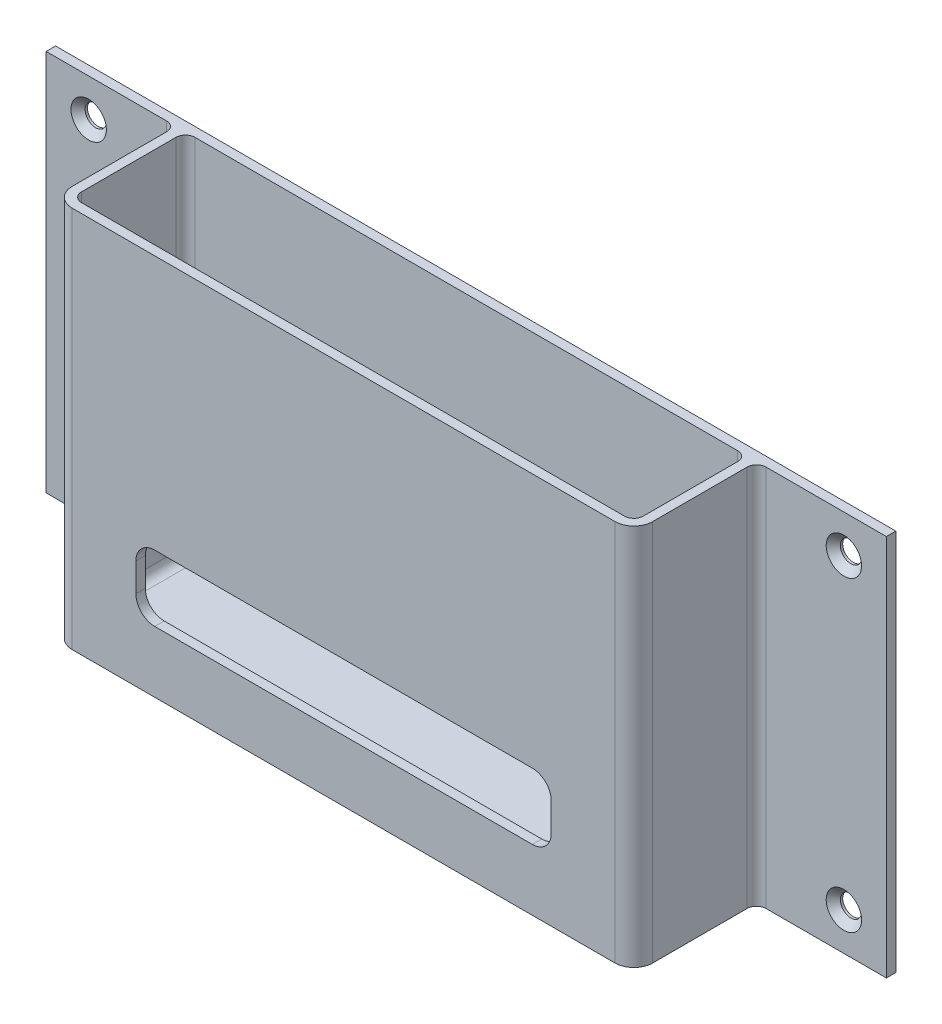
from build123d import *

# Parameters (mm, degrees)
BOSS_EXTRUDE1_DEPTH = 78
BOSS_EXTRUDE2_START = 3
BOSS_EXTRUDE2_DEPTH = 3
CUT_EXTRUDE1_DEPTH  = 2
FILLET1_R           = 2
SKETCH5_R           = 2.25
CUT_EXTRUDE2_DEPTH  = 122.165176515
CHAMFER1_SIZE       = 1.5


with BuildPart() as part:
    # Sketch2 → Boss-Extrude1 (new body)
    with BuildSketch(Plane(origin=(0, 0, 0), x_dir=(1, 0, 0), z_dir=(0, 1, 0))):
        with BuildLine():
            Line((89, 0), (-89, 0))
            Line((-89, 0), (-89, -2))
            Line((-89, -2), (-63.5, -2))
            ThreePointArc((-63.5, -2), (-62.085786438, -2.585786438), (-61.5, -4))
            Line((-61.5, -4), (-61.5, -24))
            ThreePointArc((-61.5, -24), (-60.328427125, -26.828427125), (-57.5, -28))
            Line((-57.5, -28), (57.5, -28))
            ThreePointArc((57.5, -28), (60.328427125, -26.828427125), (61.5, -24))
            Line((61.5, -24), (61.5, -4))
            ThreePointArc((61.5, -4), (62.085786438, -2.585786438), (63.5, -2))
            Line((63.5, -2), (89, -2))
            Line((89, -2), (89, 0))
        make_face()
        with BuildLine():
            Line((57.5, -2), (-57.5, -2))
            ThreePointArc((-57.5, -2), (-58.914213562, -2.585786438), (-59.5, -4))
            Line((-59.5, -4), (-59.5, -24))
            ThreePointArc((-59.5, -24), (-58.914213562, -25.414213562), (-57.5, -26))
            Line((-57.5, -26), (57.5, -26))
            ThreePointArc((57.5, -26), (58.914213562, -25.414213562), (59.5, -24))
            Line((59.5, -24), (59.5, -4))
            ThreePointArc((59.5, -4), (58.914213562, -2.585786438), (57.5, -2))
        make_face(mode=Mode.SUBTRACT)
    extrude(amount=BOSS_EXTRUDE1_DEPTH)

    # Sketch3 → Boss-Extrude2 (add)
    with BuildSketch(Plane.XZ.offset(BOSS_EXTRUDE2_START)):
        with BuildLine():
            Line((-89, 2), (-89, 0))
            Line((-89, 0), (89, 0))
            Line((89, 0), (89, 2))
            Line((89, 2), (63.5, 2))
            ThreePointArc((63.5, 2), (62.085786438, 2.585786438), (61.5, 4))
            Line((61.5, 4), (61.5, 24))
            ThreePointArc((61.5, 24), (60.328427125, 26.828427125), (57.5, 28))
            Line((57.5, 28), (-57.5, 28))
            ThreePointArc((-57.5, 28), (-60.328427125, 26.828427125), (-61.5, 24))
            Line((-61.5, 24), (-61.5, 4))
            ThreePointArc((-61.5, 4), (-62.085786438, 2.585786438), (-63.5, 2))
            Line((-63.5, 2), (-89, 2))
        make_face()
    extrude(amount=-BOSS_EXTRUDE2_DEPTH)

    # Sketch4 → Cut-Extrude1 (cut)
    with BuildSketch(Plane.XY.offset(28)):
        with BuildLine():
            Line((-40, 24), (40, 24))
            ThreePointArc((40, 24), (42.828427125, 22.828427125), (44, 20))
            Line((44, 20), (44, 14))
            ThreePointArc((44, 14), (42.828427125, 11.171572875), (40, 10))
            Line((40, 10), (-40, 10))
            ThreePointArc((-40, 10), (-42.828427125, 11.171572875), (-44, 14))
            Line((-44, 14), (-44, 20))
            ThreePointArc((-44, 20), (-42.828427125, 22.828427125), (-40, 24))
        make_face()
    extrude(amount=-CUT_EXTRUDE1_DEPTH, mode=Mode.SUBTRACT)

    # Fillet1
    fillet1_edges = [part.edges().sort_by_distance(p)[0] for p in [
        (58.914213562, 0, 25.414213562),
        (59.5, 0, 14),
        (58.914213562, 0, 2.585786438),
        (0, 0, 2),
        (-58.914213562, 0, 2.585786438),
        (-59.5, 0, 14),
        (-58.914213562, 0, 25.414213562),
        (0, 0, 26),
    ]]
    fillet(fillet1_edges, radius=FILLET1_R)

    # Sketch5 → Cut-Extrude2 (cut, through all)
    with BuildSketch(Plane.XY.offset(2)):
        with Locations((-80, 70)):
            Circle(SKETCH5_R)
        with Locations((-80, 5)):
            Circle(SKETCH5_R)
        with Locations((80, 5)):
            Circle(SKETCH5_R)
        with Locations((80, 70)):
            Circle(SKETCH5_R)
    extrude(amount=-CUT_EXTRUDE2_DEPTH, mode=Mode.SUBTRACT)

    # Chamfer1
    chamfer1_edges = [part.edges().sort_by_distance(p)[0] for p in [
        (77.75, 70, 2),
        (77.75, 5, 2),
        (-82.25, 5, 2),
        (-82.25, 70, 2),
    ]]
    chamfer(chamfer1_edges, length=CHAMFER1_SIZE)


solid = part.part
